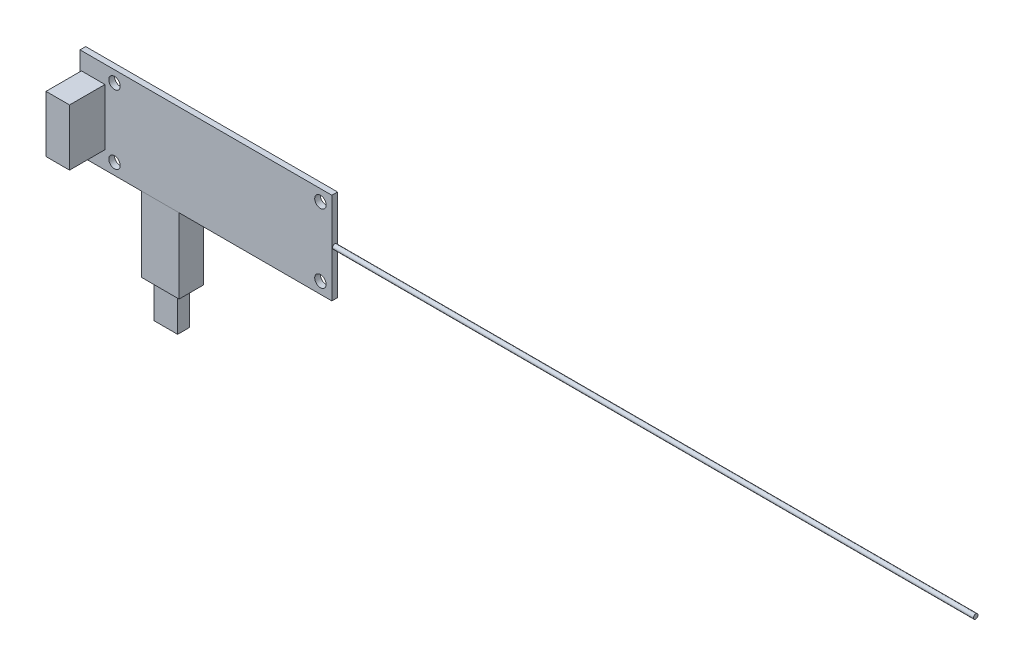
from build123d import *

# Parameters (mm, degrees)
SKETCH1_W                             = 69.85
SKETCH1_H                             = 25.4
EXTRUDE1_DEPTH                        = 1.5748
F_1_8_0_125_DIAMETER_HOLE1_AT_2_COUNT = 2
F_1_8_0_125_DIAMETER_HOLE1_AT_2_PITCH = 57.13222
SKETCH4_R                             = 0.635
BOSS_EXTRUDE1_DEPTH                   = 177.8
SKETCH5_W                             = 8.128
SKETCH5_H                             = 8.7376
USB_CONNECTOR_DEPTH                   = 4.1402
SKETCH6_W                             = 10.40639215
SKETCH6_H                             = 6.781860105
CHARGER_DEPTH                         = 20.828
SKETCH7_W                             = 6.585703948
SKETCH7_H                             = 3.257259008
BOSS_EXTRUDE2_DEPTH                   = 10.16
SKETCH8_W                             = 6.5278
SKETCH8_H                             = 15.6718
BOSS_EXTRUDE3_DEPTH                   = 9.8298


with BuildPart() as part:
    # Sketch1 → Extrude1 (new body)
    with BuildSketch(Plane.XY):
        Rectangle(SKETCH1_W, SKETCH1_H)
    extrude(amount=EXTRUDE1_DEPTH)

    # Sketch3 → 1/8 (0.125) Diameter Hole1 (revolve, cut)
    with BuildSketch(Plane(origin=(-25.38222, 9.525, 1.5748), x_dir=(0, -1, 0), z_dir=(1, 0, 0))):
        Polygon((0, 0), (0, 16.955866233), (1.5875, 16.002), (1.5875, 0), align=None)
    f_1_8_0_125_diameter_hole1 = revolve(axis=Axis((-25.38222, 9.525, 7.9248), (0, 0, -1)), mode=Mode.SUBTRACT)

    # 1/8 (0.125) Diameter Hole1 at 2: 1/8 (0.125) Diameter Hole1 ×2
    with Locations(*[(i * F_1_8_0_125_DIAMETER_HOLE1_AT_2_PITCH, 0, 0) for i in range(1, F_1_8_0_125_DIAMETER_HOLE1_AT_2_COUNT)]):
        add(f_1_8_0_125_diameter_hole1, mode=Mode.SUBTRACT)

    # Mirror1: 1/8 (0.125) Diameter Hole1 across plane
    add(f_1_8_0_125_diameter_hole1.mirror(Plane.ZX), mode=Mode.SUBTRACT)

    # Mirror1 copy 1 sketch → Mirror1 copy 1 (revolve, cut)
    with BuildSketch(Plane(origin=(31.75, -9.525, 1.5748), x_dir=(0, 1, 0), z_dir=(1, 0, 0))):
        Polygon((0, 0), (0, -16.955866233), (1.5875, -16.002), (1.5875, 0), align=None)
    revolve(axis=Axis((31.75, -9.525, 7.9248), (0, 0, 1)), mode=Mode.SUBTRACT)

    # Sketch4 → Boss-Extrude1 (add)
    with BuildSketch(Plane(origin=(34.925, 0, 0), x_dir=(0, 0, -1), z_dir=(1, 0, 0))):
        with Locations(Location((-0.772028936, 0, 0), (0, 0, 180))):
            Circle(SKETCH4_R)
    extrude(amount=BOSS_EXTRUDE1_DEPTH)

    # Sketch5 → USB Connector (add)
    with BuildSketch(Plane(origin=(0, 0, 0), x_dir=(-1, 0, 0), z_dir=(0, 0, -1))):
        with Locations((13.072066229, -8.3312)):
            Rectangle(SKETCH5_W, SKETCH5_H)
    extrude(amount=USB_CONNECTOR_DEPTH)

    # Sketch6 → Charger (add)
    with BuildSketch(Plane.XZ.offset(12.7)):
        with Locations((-12.751236003, -1.907476131)):
            Rectangle(SKETCH6_W, SKETCH6_H)
    extrude(amount=CHARGER_DEPTH)

    # Sketch7 → Boss-Extrude2 (add)
    with BuildSketch(Plane.XZ.offset(33.528)):
        with Locations((-12.72298233, -1.628596112)):
            Rectangle(SKETCH7_W, SKETCH7_H)
    extrude(amount=BOSS_EXTRUDE2_DEPTH)

    # Sketch8 → Boss-Extrude3 (add)
    with BuildSketch(Plane.XY.offset(1.5748)):
        with Locations((-31.2801, 0)):
            Rectangle(SKETCH8_W, SKETCH8_H)
    extrude(amount=BOSS_EXTRUDE3_DEPTH)


solid = part.part
